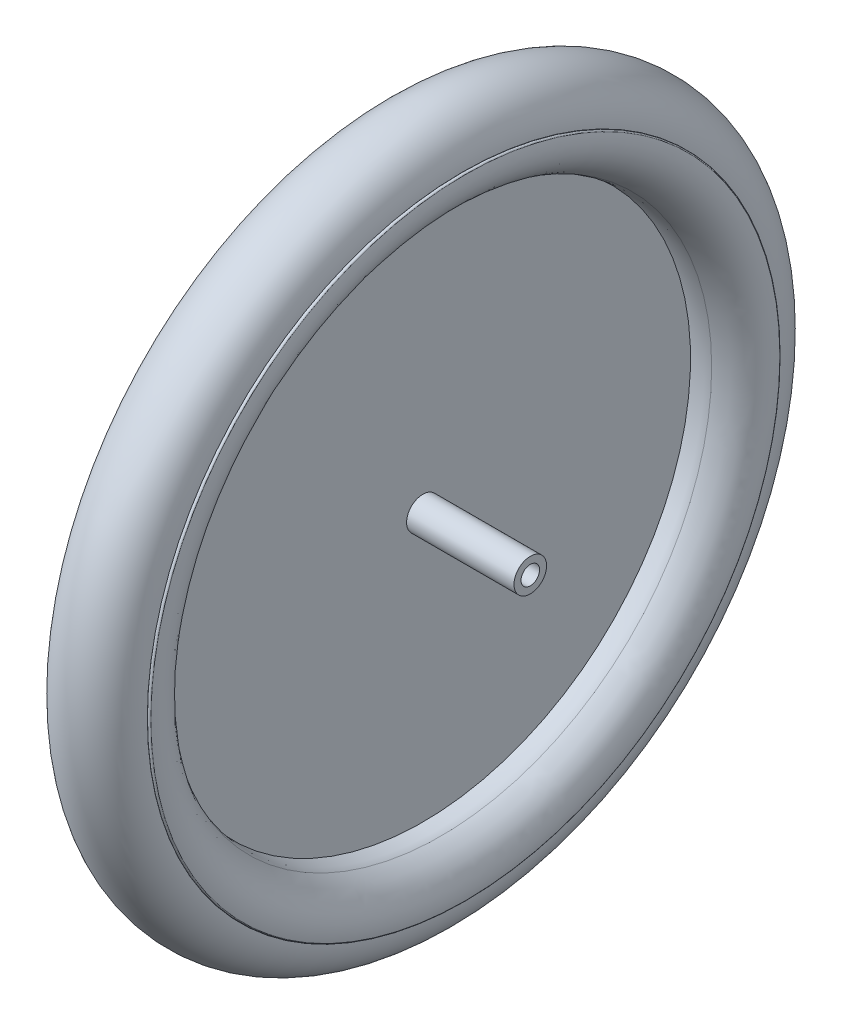
from build123d import *

# Parameters (mm, degrees)
BOSS_EXTRUDE1_DEPTH      = 59
BOSS_EXTRUDE1_DEPTH_BACK = 59
SKETCH3_R                = 8.8
SKETCH3_R_2              = 5
BOSS_EXTRUDE2_DEPTH      = 1
BOSS_EXTRUDE2_DEPTH_BACK = 1
SKETCH4_R                = 146.258422724


with BuildPart() as part:
    # Sketch2 → Revolve1 (revolve)
    with BuildSketch(Plane.XY, mode=Mode.PRIVATE) as revolve1_sk:
        with BuildLine():
            ThreePointArc((-22.5, 170.25), (0, 192.75), (22.5, 170.25))
            ThreePointArc((22.5, 170.25), (23.348567439, 170.353130477), (23.966808975, 169.762808533))
            add(Edge.make_bspline(
                [(23.966808975, 169.762808533), (26.721829909, 157.734548001), (18.783773363, 150.081329337), (10.671555184, 146.258422724)],
                knots=[0, 0, 0, 0, 1, 1, 1, 1], degree=3))
            add(Edge.make_bspline(
                [(-10.671555184, 146.258422724), (-5.819418174, 143.971838924), (6.402330555, 143.852391413), (10.671555184, 146.258422724)],
                knots=[0, 0, 0, 0, 1, 1, 1, 1], degree=3))
            add(Edge.make_bspline(
                [(-23.966808975, 169.762808533), (-26.721829909, 157.734548001), (-18.783773363, 150.081329337), (-10.671555184, 146.258422724)],
                knots=[0, 0, 0, 0, 1, 1, 1, 1], degree=3))
            ThreePointArc((-23.966808975, 169.762808533), (-23.348567439, 170.353130477), (-22.5, 170.25))
        make_face()
    revolve(revolve1_sk.sketch.rotate(Axis((0, 0, 0), (1, 0, 0)), 90), axis=Axis((0, 0, 0), (1, 0, 0)))



with BuildPart() as body_2:
    # Sketch3 → Boss-Extrude1 (new, two sides: drawn at the far end of the back side and taken through both)
    with BuildSketch(Plane(origin=(0, 0, 0), x_dir=(0, 0, -1), z_dir=(1, 0, 0)).offset(-BOSS_EXTRUDE1_DEPTH_BACK)):
        Circle(SKETCH3_R)
        Circle(SKETCH3_R_2, mode=Mode.SUBTRACT)
    extrude(amount=BOSS_EXTRUDE1_DEPTH + BOSS_EXTRUDE1_DEPTH_BACK)


with BuildPart() as part_1:
    add(part.part)

    add(body_2.part)  # Boss-Extrude2 merges body 2
    # Sketch4 → Boss-Extrude2 (add, two sides: drawn at the far end of the back side and taken through both)
    with BuildSketch(Plane(origin=(0, 0, 0), x_dir=(0, 0, -1), z_dir=(1, 0, 0)).offset(-BOSS_EXTRUDE2_DEPTH_BACK)):
        Circle(SKETCH4_R)
    extrude(amount=BOSS_EXTRUDE2_DEPTH + BOSS_EXTRUDE2_DEPTH_BACK)


solid = part_1.part
